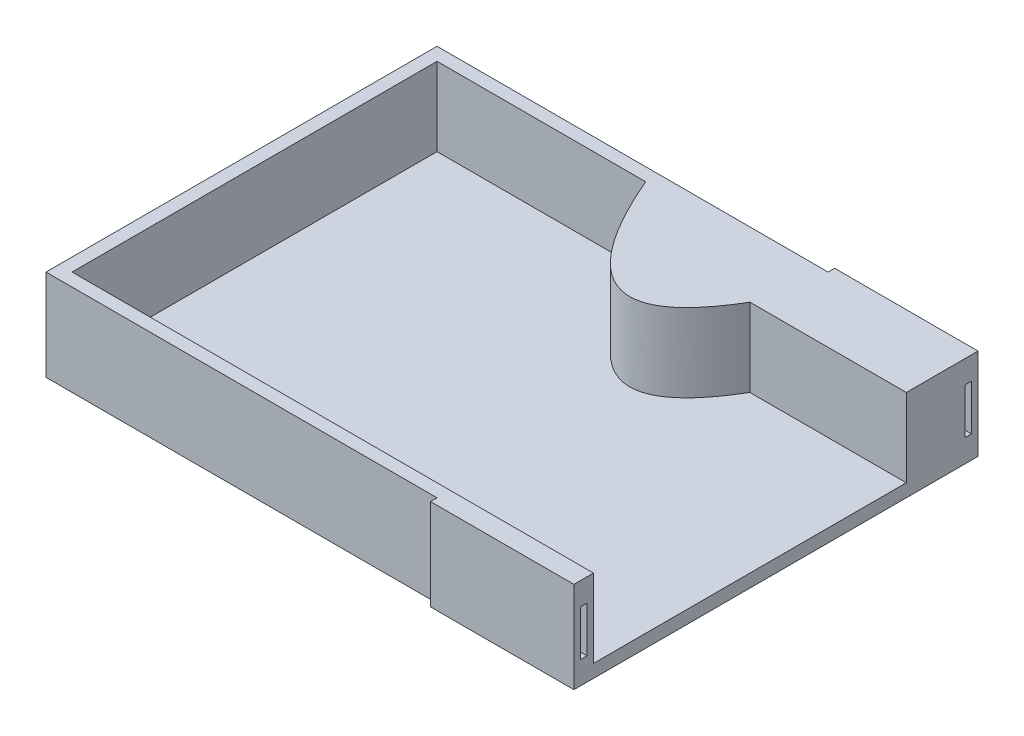
from build123d import *

# Parameters (mm, degrees)
SALIENTE_EXTRUIR5_DEPTH  = 35
SALIENTE_EXTRUIR6_DEPTH  = 5
CROQUIS8_W               = 200
CROQUIS8_H               = 35
SALIENTE_EXTRUIR8_DEPTH  = 5
CROQUIS7_W               = 200
CROQUIS7_H               = 35
SALIENTE_EXTRUIR9_DEPTH  = 5
CROQUIS10_W              = 150
CROQUIS10_H              = 35
SALIENTE_EXTRUIR10_DEPTH = 5
CROQUIS11_W              = 50
CROQUIS11_H              = 17.5
CORTAR_EXTRUIR1_DEPTH    = 2.5
CROQUIS12_W              = 50
CROQUIS12_H              = 17.5
CORTAR_EXTRUIR2_DEPTH    = 2.5
CROQUIS13_W              = 55
CROQUIS13_H              = 35
SALIENTE_EXTRUIR11_DEPTH = 2.5
CROQUIS14_W              = 55
CROQUIS14_H              = 35
SALIENTE_EXTRUIR12_DEPTH = 2.5
CORTAR_EXTRUIR3_START    = -5
CORTAR_EXTRUIR3_DEPTH    = 40


with BuildPart() as part:
    # Croquis2 → Saliente-Extruir5 (new body)
    with BuildSketch(Plane(origin=(0, 0, 0), x_dir=(1, 0, 0), z_dir=(0, 1, 0))):
        with BuildLine():
            Line((-60, 70), (-120, 70))
            add(Edge.make_bspline(
                [(-120, 70), (-89.713167171, -0.733691908), (-60, 50)],
                knots=[0, 0, 0, 1, 1, 1], degree=2))
            Line((-60, 50), (0, 50))
            Line((0, 50), (0, 70))
            Line((0, 70), (-60, 70))
        make_face()
    extrude(amount=SALIENTE_EXTRUIR5_DEPTH)

    # Croquis2<6> → Saliente-Extruir6 (add)
    with BuildSketch(Plane(origin=(0, 0, 0), x_dir=(1, 0, 0), z_dir=(0, 1, 0))):
        with BuildLine():
            Line((-120, 70), (-200, 70))
            Line((-200, 70), (-200, -70))
            Line((-200, -70), (0, -70))
            Line((0, -70), (0, 50))
            Line((0, 50), (-60, 50))
            add(Edge.make_bspline(
                [(-120, 70), (-89.713167171, -0.733691908), (-60, 50)],
                knots=[0, 0, 0, 1, 1, 1], degree=2))
        make_face()
    extrude(amount=SALIENTE_EXTRUIR6_DEPTH)

    # Croquis8 → Saliente-Extruir8 (add)
    with BuildSketch(Plane(origin=(0, 0, -70), x_dir=(-1, 0, 0), z_dir=(0, 0, -1))):
        with Locations((100, 17.5)):
            Rectangle(CROQUIS8_W, CROQUIS8_H)
    extrude(amount=SALIENTE_EXTRUIR8_DEPTH)

    # Croquis7 → Saliente-Extruir9 (add)
    with BuildSketch(Plane.XY.offset(70)):
        with Locations((-100, 17.5)):
            Rectangle(CROQUIS7_W, CROQUIS7_H)
    extrude(amount=SALIENTE_EXTRUIR9_DEPTH)

    # Croquis10 → Saliente-Extruir10 (add)
    with BuildSketch(Plane.ZY.offset(200)):
        with Locations((0, 17.5)):
            Rectangle(CROQUIS10_W, CROQUIS10_H)
    extrude(amount=SALIENTE_EXTRUIR10_DEPTH)

    # Croquis11 → Cortar-Extruir1 (cut)
    with BuildSketch(Plane.XY.offset(75)):
        with Locations((-25, 17.5)):
            Rectangle(CROQUIS11_W, CROQUIS11_H)
    extrude(amount=-CORTAR_EXTRUIR1_DEPTH, mode=Mode.SUBTRACT)

    # Croquis12 → Cortar-Extruir2 (cut)
    with BuildSketch(Plane(origin=(0, 0, -75), x_dir=(-1, 0, 0), z_dir=(0, 0, -1))):
        with Locations((25, 17.5)):
            Rectangle(CROQUIS12_W, CROQUIS12_H)
    extrude(amount=-CORTAR_EXTRUIR2_DEPTH, mode=Mode.SUBTRACT)

    # Croquis13 → Saliente-Extruir11 (add)
    with BuildSketch(Plane.XY.offset(75)):
        with Locations((-27.5, 17.5)):
            Rectangle(CROQUIS13_W, CROQUIS13_H)
    extrude(amount=SALIENTE_EXTRUIR11_DEPTH)

    # Croquis14 → Saliente-Extruir12 (add)
    with BuildSketch(Plane(origin=(0, 0, -75), x_dir=(-1, 0, 0), z_dir=(0, 0, -1))):
        with Locations((27.5, 17.5)):
            Rectangle(CROQUIS14_W, CROQUIS14_H)
    extrude(amount=SALIENTE_EXTRUIR12_DEPTH)

    # Croquis15 → Cortar-Extruir3 (cut)
    with BuildSketch(Plane(origin=(0, 35, 0), x_dir=(1, 0, 0), z_dir=(0, 1, 0)).offset(CORTAR_EXTRUIR3_START)):
        with BuildLine():
            Line((-114.377865487, 70), (-5, 70))
            Line((-5, 70), (-5, 55))
            Line((-5, 55), (-62.909565923, 55))
            add(Edge.make_bspline(
                [(-62.909565923, 55), (-63.466265427, 54.021602214), (-64.401186981, 52.372327996), (-65.10401925, 51.155937563), (-66.343867423, 49.084457263), (-69.328375649, 44.517477078), (-74.11230077, 38.812847857), (-78.500104352, 35.511092249), (-81.30486337, 34.292403361), (-83.396178275, 33.823757561), (-85.433716297, 33.792096113), (-88.081814147, 34.294431754), (-92.286089613, 36.365158599), (-99.205160513, 42.585467381), (-103.799594749, 49.425151944)],
                knots=[-0.031024165, -0.031024165, -0.031024165, -0.006934179, 0.009125811, 0.025185801, 0.065335777, 0.16169572, 0.290175643, 0.386535585, 0.450775546, 0.515015508, 0.579255469, 0.675615411, 0.804095334, 0.996815219, 0.996815219, 0.996815219], degree=2))
            Line((-103.799594749, 49.425151944), (-114.377865487, 70))
        make_face()
    extrude(amount=-CORTAR_EXTRUIR3_DEPTH, mode=Mode.SUBTRACT)


solid = part.part
